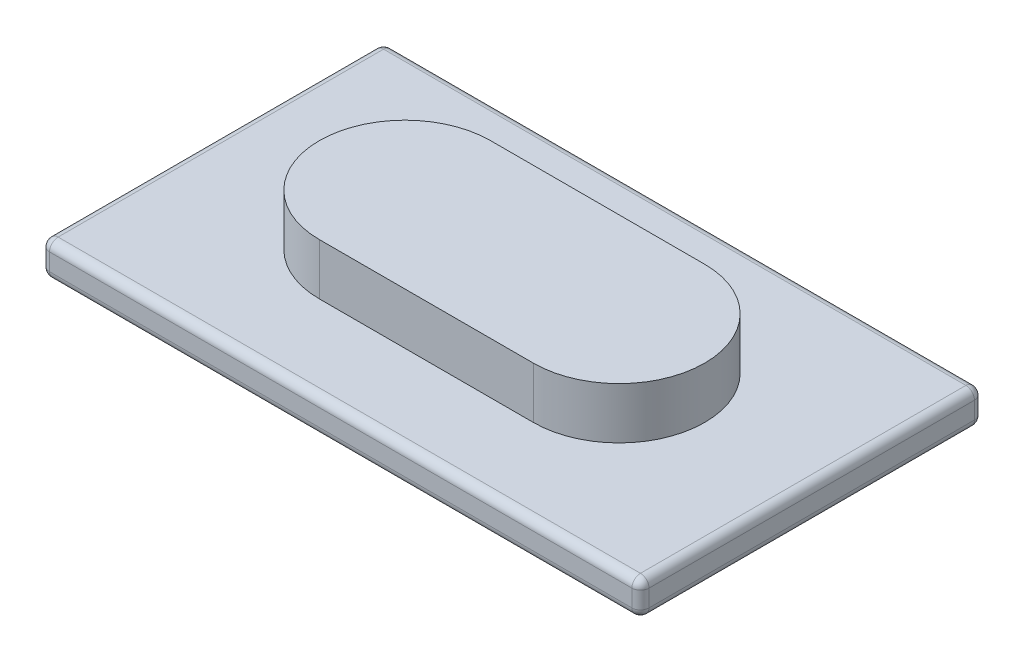
from build123d import *

# Parameters (mm, degrees)
SKETCH1_W           = 700
SKETCH1_H           = 400
BOSS_EXTRUDE1_DEPTH = 40
FILLET1_R           = 10
SKETCH2_W           = 450
SKETCH2_H           = 200
BOSS_EXTRUDE2_DEPTH = 60
FILLET2_RADIUS      = 100
FILLET2_LENGTH      = 60
FILLET3_RADIUS      = 100
FILLET3_LENGTH      = 60


with BuildPart() as part:
    # Sketch1 → Boss-Extrude1 (new body)
    with BuildSketch(Plane(origin=(0, 0, 0), x_dir=(1, 0, 0), z_dir=(0, 1, 0))):
        Rectangle(SKETCH1_W, SKETCH1_H)
    extrude(amount=BOSS_EXTRUDE1_DEPTH)

    # Fillet1
    fillet1_edges = [part.edges().sort_by_distance(p)[0] for p in [
        (-350, 40, 0),
        (0, 40, 200),
        (350, 40, 0),
        (0, 0, 200),
        (-350, 0, 0),
        (0, 0, -200),
        (350, 0, 0),
        (350, 20, 200),
        (-350, 20, 200),
        (-350, 20, -200),
        (350, 20, -200),
        (0, 40, -200),
    ]]
    fillet(fillet1_edges, radius=FILLET1_R)

    # Sketch2 → Boss-Extrude2 (add)
    with BuildSketch(Plane(origin=(0, 40, 0), x_dir=(1, 0, 0), z_dir=(0, 1, 0))):
        Rectangle(SKETCH2_W, SKETCH2_H)
    extrude(amount=BOSS_EXTRUDE2_DEPTH)

    # Fillet2: full round fillet: the end face becomes a half cylinder, R = half its width
    fillet2_face = Plane((225, 70, 0), x_dir=(0, -1, 0), z_dir=(1, 0, 0))  # on the end face: x along it, z out of the body
    fillet2_slab = fillet2_face.offset(-FILLET2_RADIUS / 2) * Box(FILLET2_LENGTH, 2 * FILLET2_RADIUS, FILLET2_RADIUS, mode=Mode.PRIVATE)  # the body's end, R deep
    fillet2_round = Plane((125, 70, 0), x_dir=(1, 0, 0), z_dir=(0, -1, 0)) * Cylinder(FILLET2_RADIUS, FILLET2_LENGTH, mode=Mode.PRIVATE)  # its axis R under the face
    add(fillet2_slab - fillet2_round, mode=Mode.SUBTRACT)

    # Fillet3: full round fillet: the end face becomes a half cylinder, R = half its width
    fillet3_face = Plane((-225, 70, 0), x_dir=(0, -1, 0), z_dir=(-1, 0, 0))  # on the end face: x along it, z out of the body
    fillet3_slab = fillet3_face.offset(-FILLET3_RADIUS / 2) * Box(FILLET3_LENGTH, 2 * FILLET3_RADIUS, FILLET3_RADIUS, mode=Mode.PRIVATE)  # the body's end, R deep
    fillet3_round = Plane((-125, 70, 0), x_dir=(-1, 0, 0), z_dir=(0, -1, 0)) * Cylinder(FILLET3_RADIUS, FILLET3_LENGTH, mode=Mode.PRIVATE)  # its axis R under the face
    add(fillet3_slab - fillet3_round, mode=Mode.SUBTRACT)


solid = part.part
